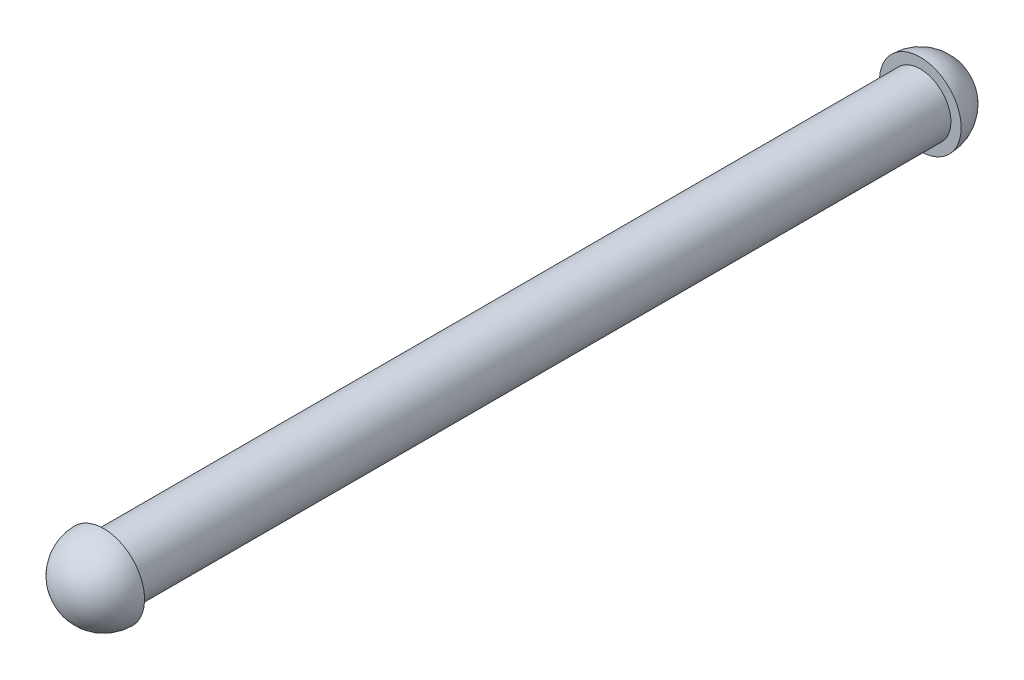
from build123d import *

# Parameters (mm, degrees)
REVOLVE_1_ANGLE = 180
SKETCH_2_R      = 0.375
EXTRUDE_1_DEPTH = 10
REVOLVE_2_ANGLE = 180


with BuildPart() as part:
    # 草图1 → 旋转1 (revolve)
    with BuildSketch(Plane.XY):
        with BuildLine():
            Line((-0.5, 0), (0.5, 0))
            ThreePointArc((0.5, 0), (0, -0.5), (-0.5, 0))
        make_face()
    revolve(axis=Axis((-0.5, 0, 0), (1, 0, 0)), revolution_arc=REVOLVE_1_ANGLE)

    # 草图2 → 凸台-拉伸1 (add)
    with BuildSketch(Plane.XY):
        with Locations(Location((0, 0, 0), (0, 0, 90))):
            Circle(SKETCH_2_R)
    extrude(amount=EXTRUDE_1_DEPTH)

    # 草图3 → 旋转2 (revolve)
    with BuildSketch(Plane.XY.offset(10)):
        with BuildLine():
            Line((0, 0.5), (0, -0.5))
            ThreePointArc((0, -0.5), (-0.5, 0), (0, 0.5))
        make_face()
    revolve(axis=Axis((0, 0.5, 10), (0, 1, 0)), revolution_arc=REVOLVE_2_ANGLE)


solid = part.part
